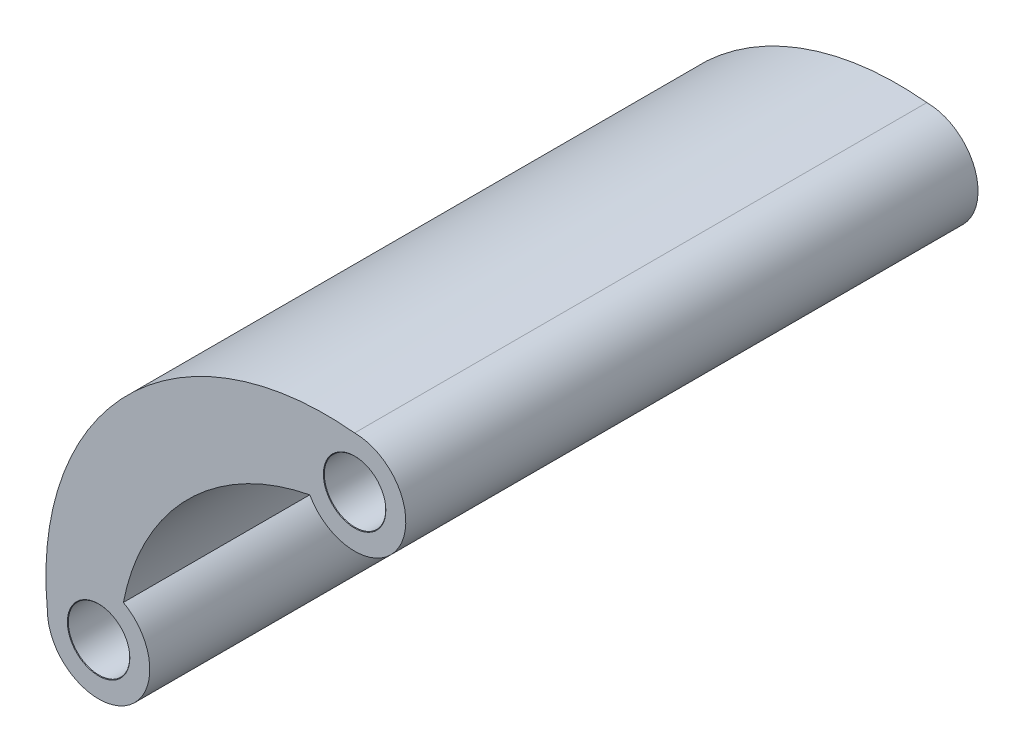
from build123d import *

# Parameters (mm, degrees)
BOSS_EXTRUDE1_DEPTH             = 27.94
F_3_0MM_DOWEL_HOLE1_D           = 3
F_3_0MM_DOWEL_HOLE1_CSINK_D     = 3.05
F_3_0MM_DOWEL_HOLE1_CSINK_ANGLE = 100


with BuildPart() as part:
    # Sketch1 → Boss-Extrude1 (new body)
    with BuildSketch(Plane(origin=(0, 0, 0), x_dir=(0, 1, 0), z_dir=(0, 0, 1))):
        with BuildLine():
            ThreePointArc((0, 15), (-2.153485547, 11.23015749), (2.187669993, 11.29))
            ThreePointArc((2.187669993, 11.29), (8.131727984, 8.131727984), (11.29, 2.187669993))
            ThreePointArc((11.29, 2.187669993), (11.23015749, -2.153485547), (15, 0))
            ThreePointArc((15, 0), (11.072722586, 11.072722586), (0, 15))
        make_face()
    extrude(amount=BOSS_EXTRUDE1_DEPTH)

    # Ø3.0mm Dowel Hole1 (through all)
    with Locations(Plane.XY.offset(27.94)):
        with Locations((0, 12.5), (0, -12.5), (-12.5, 0)):
            CounterSinkHole(F_3_0MM_DOWEL_HOLE1_D / 2, F_3_0MM_DOWEL_HOLE1_CSINK_D / 2, counter_sink_angle=F_3_0MM_DOWEL_HOLE1_CSINK_ANGLE)


solid = part.part
